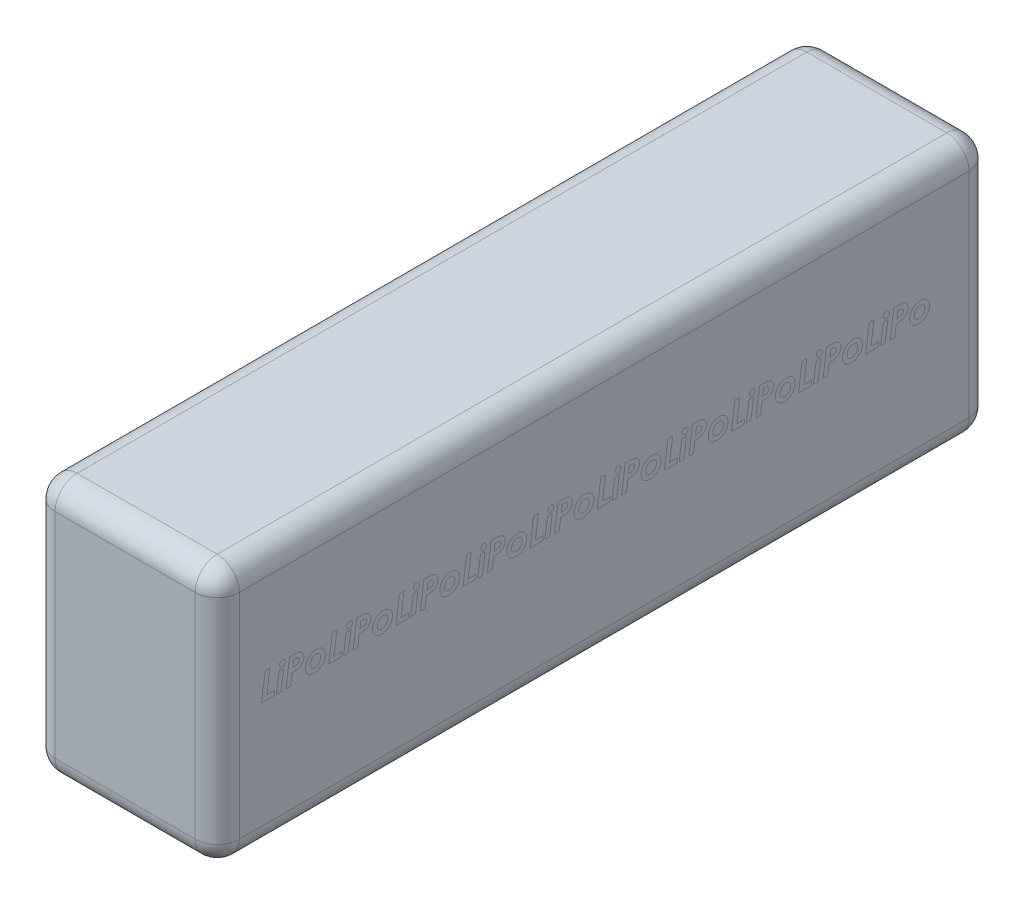
from build123d import *

# Parameters (mm, degrees)
SKETCH_2_W      = 25
SKETCH_2_H      = 35
EXTRUDE_1_DEPTH = 105
FILLET_1_R      = 3


with BuildPart() as part:
    # ｽｹｯﾁ2 → ﾎﾞｽ - 押し出し1 (new body)
    with BuildSketch(Plane.XY):
        Rectangle(SKETCH_2_W, SKETCH_2_H)
    extrude(amount=EXTRUDE_1_DEPTH)

    # ﾌｨﾚｯﾄ1
    fillet_1_edges = [part.edges().sort_by_distance(p)[0] for p in [
        (-12.5, 0, 0),
        (0, -17.5, 0),
        (12.5, 0, 0),
        (0, 17.5, 0),
        (-12.5, 0, 105),
        (0, -17.5, 105),
        (12.5, 0, 105),
        (-12.5, 17.5, 52.5),
        (12.5, 17.5, 52.5),
        (12.5, -17.5, 52.5),
        (-12.5, -17.5, 52.5),
        (0, 17.5, 105),
    ]]
    fillet(fillet_1_edges, radius=FILLET_1_R)


solid = part.part
